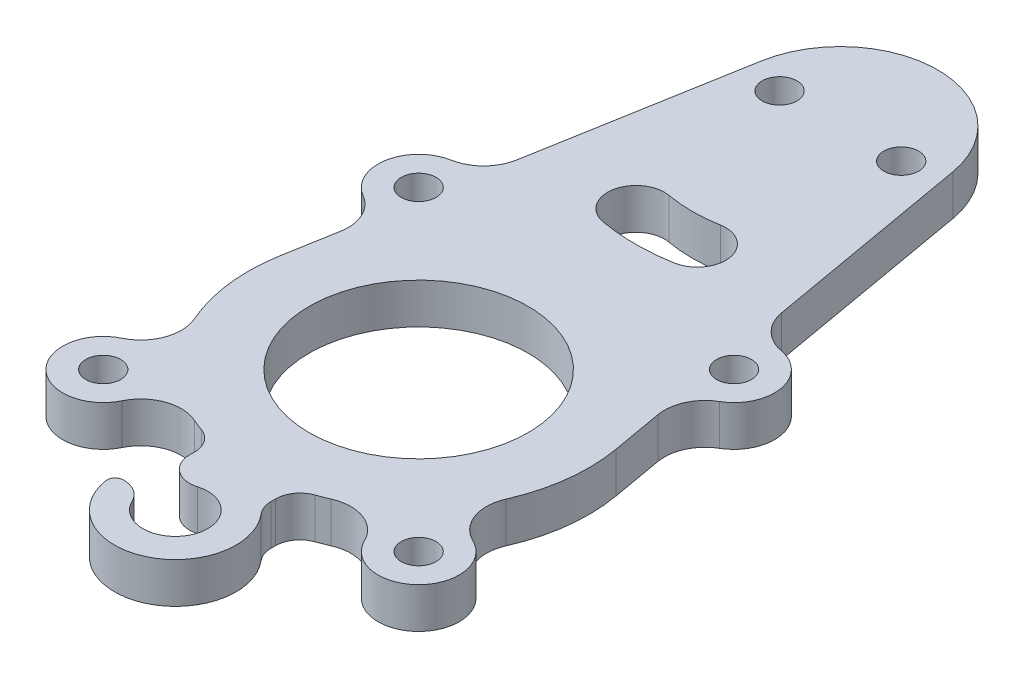
from build123d import *

# Parameters (mm, degrees)
SKETCH_1_R      = 2.15
SKETCH_1_R_2    = 13.5
EXTRUDE_1_DEPTH = 5
FILLET_1_R      = 3
FILLET_2_R      = 1


with BuildPart() as part:
    # ｽｹｯﾁ1 → ﾎﾞｽ - 押し出し1 (new body)
    with BuildSketch(Plane(origin=(0, 0, 0), x_dir=(1, 0, 0), z_dir=(0, 1, 0))):
        with BuildLine():
            Line((-11.818899718, 2.076923077), (-16.328382426, -23.584655104))
            ThreePointArc((-16.328382426, -23.584655104), (-17.703637569, -26.24099819), (-20.349180229, -27.636917003))
            ThreePointArc((-20.349180229, -27.636917003), (-24.369978032, -31.689178902), (-21.971608059, -36.869474544))
            ThreePointArc((-21.971608059, -36.869474544), (-19.960473468, -39.083706455), (-19.573238085, -42.049770186))
            Line((-19.573238085, -42.049770186), (-20.683074506, -48.365384615))
            ThreePointArc((-20.683074506, -48.365384615), (-20.849535948, -54.509352655), (-19.230026487, -60.438369589))
            ThreePointArc((-19.230026487, -60.438369589), (-19.11671849, -64.1755701), (-21.627020352, -66.946470844))
            ThreePointArc((-21.627020352, -66.946470844), (-22.980970389, -74.980970389), (-14.946470844, -73.627020352))
            ThreePointArc((-14.946470844, -73.627020352), (-12.1755701, -71.11671849), (-8.438369589, -71.230026487))
            ThreePointArc((-8.438369589, -71.230026487), (-6.744432027, -71.887499507), (-5, -72.396078054))
            Line((-5, -72.396078054), (-5, -76.409830056))
            Line((-5, -76.409830056), (-2.666666667, -79.01857603))
            ThreePointArc((-2.666666667, -79.01857603), (3.651483717, -83.632993162), (-4, -82))
            Line((-4, -82), (-7.5, -82))
            ThreePointArc((-7.5, -82), (3.061862178, -88.846531969), (5, -76.409830056))
            Line((5, -76.409830056), (5, -72.396078054))
            ThreePointArc((5, -72.396078054), (6.744432027, -71.887499507), (8.438369589, -71.230026487))
            ThreePointArc((8.438369589, -71.230026487), (12.1755701, -71.11671849), (14.946470844, -73.627020352))
            ThreePointArc((14.946470844, -73.627020352), (22.980970389, -74.980970389), (21.627020352, -66.946470844))
            ThreePointArc((21.627020352, -66.946470844), (19.11671849, -64.1755701), (19.230026487, -60.438369589))
            ThreePointArc((19.230026487, -60.438369589), (20.849535948, -54.509352655), (20.683074506, -48.365384615))
            Line((20.683074506, -48.365384615), (19.573238085, -42.049770186))
            ThreePointArc((19.573238085, -42.049770186), (19.960473468, -39.083706455), (21.971608059, -36.869474544))
            ThreePointArc((21.971608059, -36.869474544), (24.369978032, -31.689178902), (20.349180229, -27.636917003))
            ThreePointArc((20.349180229, -27.636917003), (17.703637569, -26.24099819), (16.328382426, -23.584655104))
            Line((16.328382426, -23.584655104), (11.818899718, 2.076923077))
            ThreePointArc((11.818899718, 2.076923077), (0, 12), (-11.818899718, 2.076923077))
        make_face()
        with Locations(Location((-7.5, 0, 0), (0, 0, 270))):
            Circle(SKETCH_1_R, mode=Mode.SUBTRACT)
        with Locations(Location((7.5, 0, 0), (0, 0, 90))):
            Circle(SKETCH_1_R, mode=Mode.SUBTRACT)
        with Locations(Location((0, -52, 0), (0, 0, 270))):
            Circle(SKETCH_1_R_2, mode=Mode.SUBTRACT)
        with Locations(Location((19.445436483, -32.554563517, 0), (0, 0, 270))):
            Circle(SKETCH_1_R, mode=Mode.SUBTRACT)
        with Locations(Location((19.445436483, -71.445436483, 0), (0, 0, 270))):
            Circle(SKETCH_1_R, mode=Mode.SUBTRACT)
        with Locations(Location((-19.445436483, -71.445436483, 0), (0, 0, 270))):
            Circle(SKETCH_1_R, mode=Mode.SUBTRACT)
        with Locations(Location((-19.445436483, -32.554563517, 0), (0, 0, 270))):
            Circle(SKETCH_1_R, mode=Mode.SUBTRACT)
        with BuildLine():
            ThreePointArc((-4.384616486, -24.866395764), (0, -25.25), (4.384616486, -24.866395764))
            ThreePointArc((4.384616486, -24.866395764), (7.223675, -20.811800006), (3.169079242, -17.972741492))
            ThreePointArc((3.169079242, -17.972741492), (0, -18.25), (-3.169079242, -17.972741492))
            ThreePointArc((-3.169079242, -17.972741492), (-7.223675, -20.811800006), (-4.384616486, -24.866395764))
        make_face(mode=Mode.SUBTRACT)
    extrude(amount=EXTRUDE_1_DEPTH)

    # ﾌｨﾚｯﾄ1
    fillet_1_edges = [part.edges().sort_by_distance(p)[0] for p in [
        (5, 2.5, 72.396078054),
        (5, 2.5, 76.409830056),
        (-4, 2.5, 82),
        (-2.666666667, 2.5, 79.01857603),
        (-5, 2.5, 76.409830056),
        (-5, 2.5, 72.396078054),
    ]]
    fillet(fillet_1_edges, radius=FILLET_1_R)

    # ﾌｨﾚｯﾄ2
    fillet_2_edges = [part.edges().sort_by_distance(p)[0] for p in [
        (-7.5, 2.5, 82),
    ]]
    fillet(fillet_2_edges, radius=FILLET_2_R)


solid = part.part
